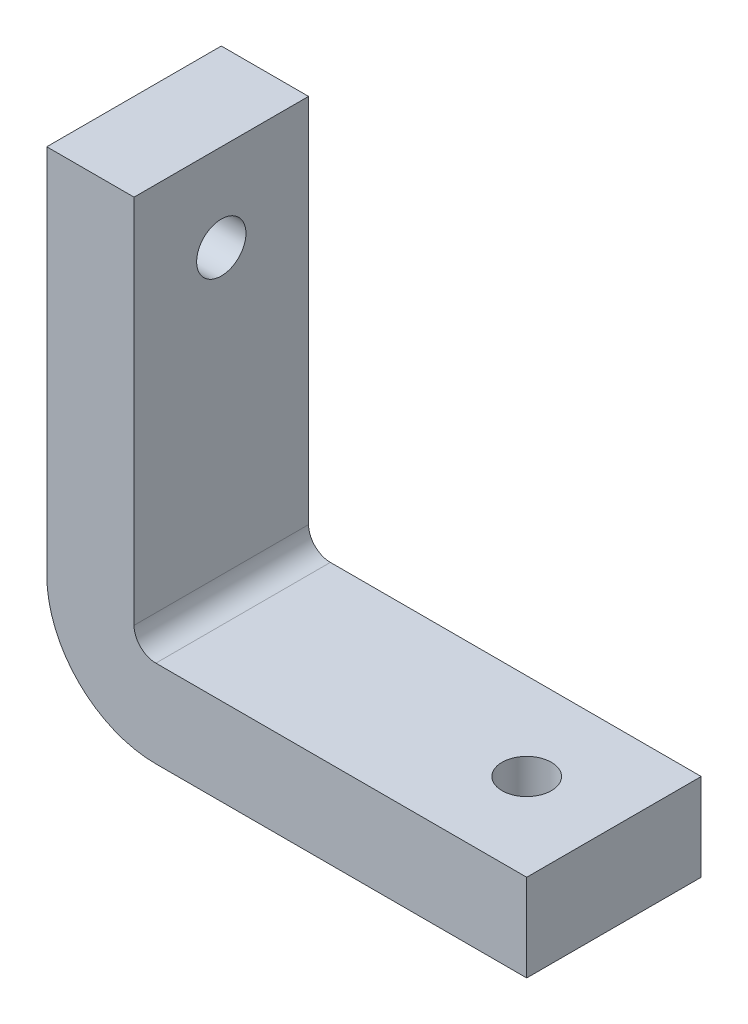
from build123d import *

# Parameters (mm, degrees)
BOSS_EXTRUDE1_DEPTH       = 4
F_4_40_TAPPED_HOLE1_D     = 2.2606
F_4_40_TAPPED_HOLE1_DEPTH = 7.6
F_4_40_TAPPED_HOLE1_TIP   = 0.679152758
F_4_40_TAPPED_HOLE2_D     = 2.2606
F_4_40_TAPPED_HOLE2_DEPTH = 7.6
F_4_40_TAPPED_HOLE2_TIP   = 0.679152758


with BuildPart() as part:
    # Sketch3 → Boss-Extrude1 (new, symmetric)
    with BuildSketch(Plane.XY):
        with BuildLine():
            Line((1, 0), (18, 0))
            Line((18, 0), (18, -4))
            Line((18, -4), (1, -4))
            ThreePointArc((1, -4), (-2.535533906, -2.535533906), (-4, 1))
            Line((-4, 1), (-4, 18))
            Line((-4, 18), (0, 18))
            Line((0, 18), (0, 1))
            ThreePointArc((0, 1), (0.292893219, 0.292893219), (1, 0))
        make_face()
    extrude(amount=BOSS_EXTRUDE1_DEPTH, both=True)

    # #4-40 Tapped Hole1
    with Locations(Plane(origin=(0, 0, 0), x_dir=(0, 0, -1), z_dir=(1, 0, 0))):
        with Locations((0, 14)):
            Hole(F_4_40_TAPPED_HOLE1_D / 2, depth=F_4_40_TAPPED_HOLE1_DEPTH)
            with Locations((0, 0, -(F_4_40_TAPPED_HOLE1_DEPTH + F_4_40_TAPPED_HOLE1_TIP / 2))):  # 118° drill point
                Cone(0, F_4_40_TAPPED_HOLE1_D / 2, F_4_40_TAPPED_HOLE1_TIP, mode=Mode.SUBTRACT)

    # #4-40 Tapped Hole2
    with Locations(Plane(origin=(0, 0, 0), x_dir=(1, 0, 0), z_dir=(0, 1, 0))):
        with Locations((14, 0)):
            Hole(F_4_40_TAPPED_HOLE2_D / 2, depth=F_4_40_TAPPED_HOLE2_DEPTH)
            with Locations((0, 0, -(F_4_40_TAPPED_HOLE2_DEPTH + F_4_40_TAPPED_HOLE2_TIP / 2))):  # 118° drill point
                Cone(0, F_4_40_TAPPED_HOLE2_D / 2, F_4_40_TAPPED_HOLE2_TIP, mode=Mode.SUBTRACT)


solid = part.part
